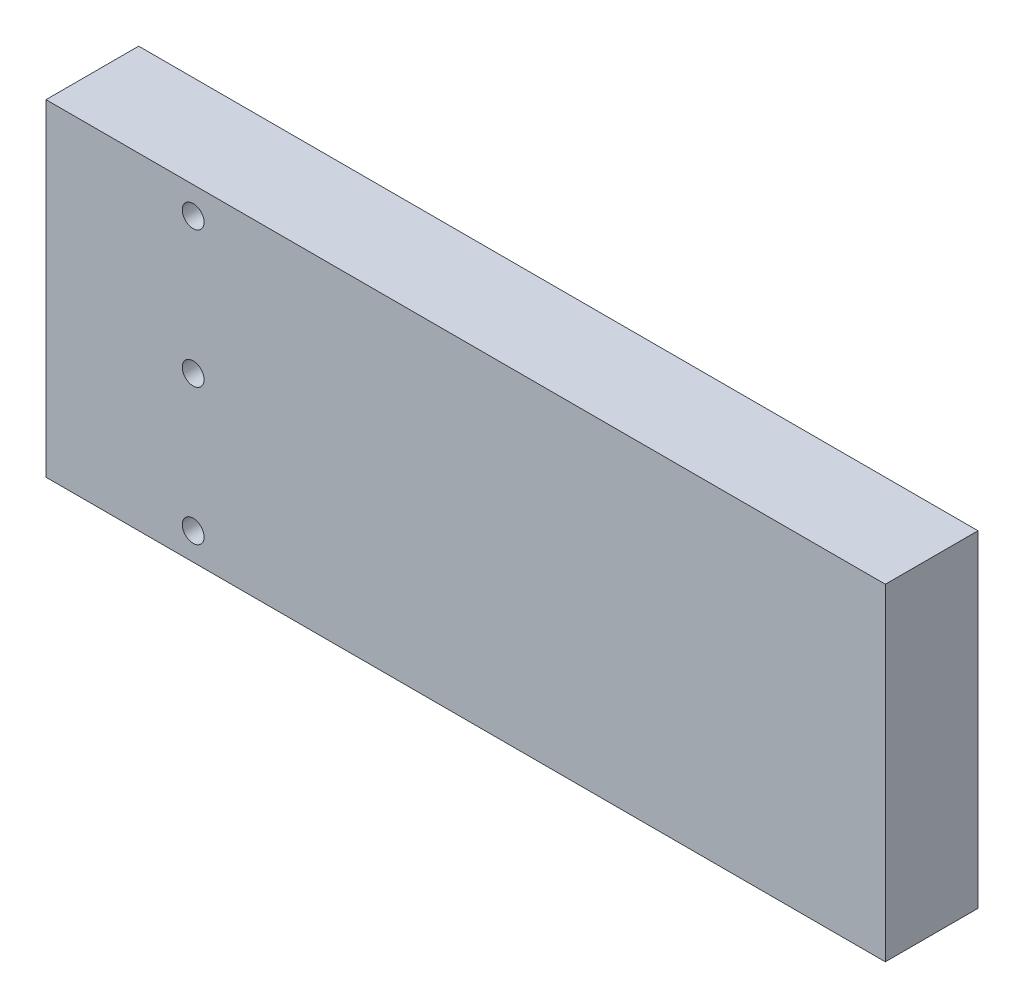
from build123d import *

# Parameters (mm, degrees)
ESQUISSE1_W        = 54
ESQUISSE1_H        = 60
ESQUISSE1_R        = 2
ESQUISSE1_W_2      = 46
BOSS_EXTRU_1_DEPTH = 17


with BuildPart() as part:
    # Esquisse1 → Boss.-Extru.1 (new body)
    # profile 1 of 3: a face of its own
    with BuildSketch(Plane.XY):
        with Locations((27, -30)):
            Rectangle(ESQUISSE1_W, ESQUISSE1_H)
        with Locations((27, -5)):
            Circle(ESQUISSE1_R, mode=Mode.SUBTRACT)
        with Locations((27, -30)):
            Circle(ESQUISSE1_R, mode=Mode.SUBTRACT)
        with Locations((27, -55)):
            Circle(ESQUISSE1_R, mode=Mode.SUBTRACT)
    # profile 2 of 3: a face of its own
    with BuildSketch(Plane.XY):
        with Locations((77, -30)):
            Rectangle(ESQUISSE1_W_2, ESQUISSE1_H)
    # profile 3 of 3: a face of its own
    with BuildSketch(Plane.XY):
        with Locations((127, -30)):
            Rectangle(ESQUISSE1_W, ESQUISSE1_H)
    extrude(amount=BOSS_EXTRU_1_DEPTH)


solid = part.part
